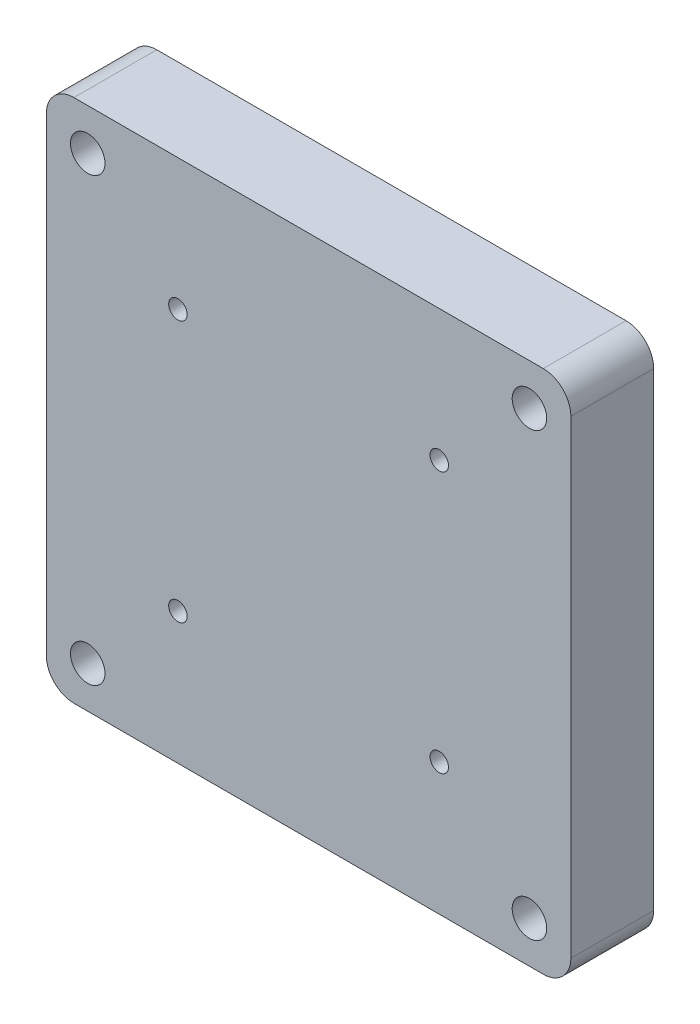
from build123d import *
from build123d.topology import SkipClean

# Parameters (mm, degrees)
SKETCH3_W           = 241.3
SKETCH3_H           = 241.3
SKETCH3_R           = 4.25
BOSS_EXTRUDE1_DEPTH = 12.7
SKETCH4_R           = 7.9375
CUT_EXTRUDE1_DEPTH  = 172.096858533
FILLET1_R           = 12.7
SKETCH5_R           = 7.9375
SKETCH5_R_2         = 10.99947
BOSS_EXTRUDE2_DEPTH = 25.4


with BuildPart() as part:
    # Sketch3 → Boss-Extrude1 (new body)
    with BuildSketch(Plane.XY):
        Rectangle(SKETCH3_W, SKETCH3_H)
        with Locations((-60.104076401, 60.208152802)):
            Circle(SKETCH3_R, mode=Mode.SUBTRACT)
        with Locations((60.104076401, 60.208152802)):
            Circle(SKETCH3_R, mode=Mode.SUBTRACT)
        with Locations((60.104076401, -60)):
            Circle(SKETCH3_R, mode=Mode.SUBTRACT)
        with Locations((-60.104076401, -60)):
            Circle(SKETCH3_R, mode=Mode.SUBTRACT)
    extrude(amount=BOSS_EXTRUDE1_DEPTH)

    # Sketch4 → Cut-Extrude1 (cut, through all)
    with BuildSketch(Plane.XY.offset(12.7)):
        with Locations((-101.6, -101.6)):
            Circle(SKETCH4_R)
        with Locations((101.6, -101.6)):
            Circle(SKETCH4_R)
        with Locations((101.6, 101.6)):
            Circle(SKETCH4_R)
        with Locations((-101.6, 101.6)):
            Circle(SKETCH4_R)
    extrude(amount=-CUT_EXTRUDE1_DEPTH, mode=Mode.SUBTRACT)

    # Fillet1
    fillet1_edges = [part.edges().sort_by_distance(p)[0] for p in [
        (-120.65, -120.65, 6.35),
        (-120.65, 120.65, 6.35),
        (120.65, 120.65, 6.35),
        (120.65, -120.65, 6.35),
    ]]
    fillet(fillet1_edges, radius=FILLET1_R)

    # Sketch5 → Boss-Extrude2 (add)
    with SkipClean():  # the faces are left unmerged after this step: merging them gives an invalid solid
        with BuildSketch(Plane(origin=(0, 0, 0), x_dir=(-1, 0, 0), z_dir=(0, 0, -1))):
            with BuildLine():
                Line((-107.95, -120.65), (107.95, -120.65))
                ThreePointArc((107.95, -120.65), (116.930256121, -116.930256121), (120.65, -107.95))
                Line((120.65, -107.95), (120.65, 107.95))
                ThreePointArc((120.65, 107.95), (116.930256121, 116.930256121), (107.95, 120.65))
                Line((107.95, 120.65), (-107.95, 120.65))
                ThreePointArc((-107.95, 120.65), (-116.930256121, 116.930256121), (-120.65, 107.95))
                Line((-120.65, 107.95), (-120.65, -107.95))
                ThreePointArc((-120.65, -107.95), (-116.930256121, -116.930256121), (-107.95, -120.65))
            make_face()
            with Locations((101.6, 101.6)):
                Circle(SKETCH5_R, mode=Mode.SUBTRACT)
            with Locations((101.6, -101.6)):
                Circle(SKETCH5_R, mode=Mode.SUBTRACT)
            with Locations((-101.6, -101.6)):
                Circle(SKETCH5_R, mode=Mode.SUBTRACT)
            with Locations((-101.6, 101.6)):
                Circle(SKETCH5_R, mode=Mode.SUBTRACT)
            with Locations((-60.104076401, 60.208152802)):
                Circle(SKETCH5_R_2, mode=Mode.SUBTRACT)
            with Locations((60.104076401, 60.208152802)):
                Circle(SKETCH5_R_2, mode=Mode.SUBTRACT)
            with Locations((60.104076401, -60)):
                Circle(SKETCH5_R_2, mode=Mode.SUBTRACT)
            with Locations((-60.104076401, -60)):
                Circle(SKETCH5_R_2, mode=Mode.SUBTRACT)
        extrude(amount=BOSS_EXTRUDE2_DEPTH)


solid = part.part
